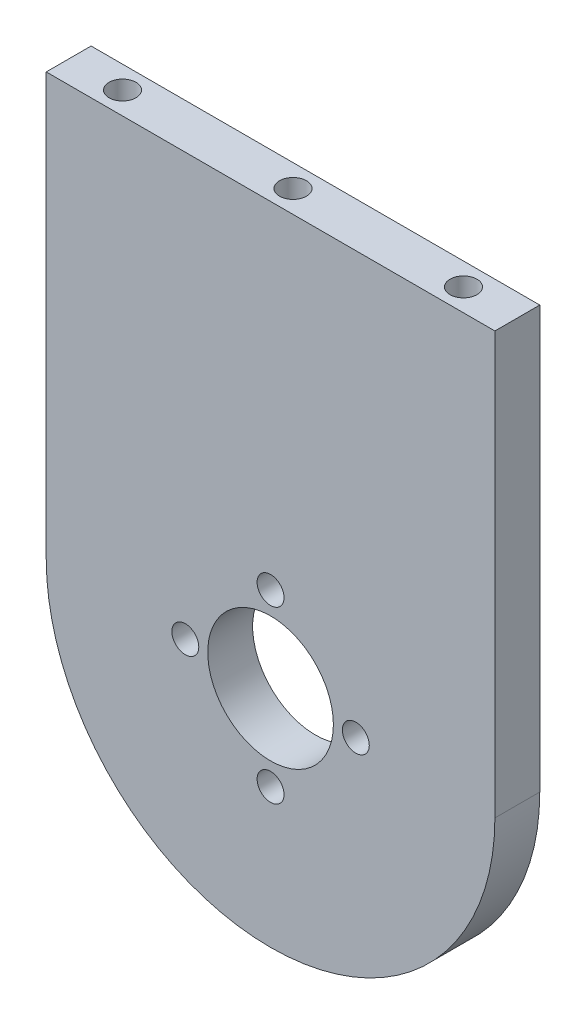
from build123d import *

# Parameters (mm, degrees)
ESQUISSE1_W             = 94
ESQUISSE1_H             = 93.807810261
ESQUISSE1_R             = 7
BOSS_EXTRU_1_DEPTH      = 5
ESQUISSE2_R             = 1.5
ENL_V_MAT_EXTRU_1_DEPTH = 67.655832453
ESQUISSE3_R             = 1.5
ENL_V_MAT_EXTRU_2_DEPTH = 10


with BuildPart() as part:
    # Esquisse1 → Boss.-Extru.1 (new body)
    with BuildSketch(Plane.XY):
        with Locations((0, 0.096094869)):
            Rectangle(ESQUISSE1_W, ESQUISSE1_H)
        Circle(ESQUISSE1_R, mode=Mode.SUBTRACT)
    extrude(amount=BOSS_EXTRU_1_DEPTH)

    # Esquisse2 → Enlèv. mat.-Extru.1 (cut, through all)
    with BuildSketch(Plane.XY.offset(5)):
        with Locations((9.5, 0)):
            Circle(ESQUISSE2_R)
        with BuildLine():
            Line((25, 47), (25, 0))
            ThreePointArc((25, 0), (0, -25), (-25, 0))
            Line((-25, 0), (-25, 47))
            Line((-25, 47), (-47, 47))
            Line((-47, 47), (-47, -46.807810261))
            Line((-47, -46.807810261), (47, -46.807810261))
            Line((47, -46.807810261), (47, 47))
            Line((47, 47), (25, 47))
        make_face()
        with Locations((-9.5, 0)):
            Circle(ESQUISSE2_R)
        with Locations((0, 9.5)):
            Circle(ESQUISSE2_R)
        with Locations((0, -9.5)):
            Circle(ESQUISSE2_R)
    extrude(amount=-ENL_V_MAT_EXTRU_1_DEPTH, mode=Mode.SUBTRACT)

    # Esquisse3 → Enlèv. mat.-Extru.2 (cut)
    with BuildSketch(Plane(origin=(0, 47, 0), x_dir=(1, 0, 0), z_dir=(0, 1, 0))):
        with Locations(Location((0, -2.5, 0), (0, 0, 270))):
            Circle(ESQUISSE3_R)
        with Locations(Location((-19, -2.5, 0), (0, 0, 270))):
            Circle(ESQUISSE3_R)
        with Locations(Location((19, -2.5, 0), (0, 0, 270))):
            Circle(ESQUISSE3_R)
    extrude(amount=-ENL_V_MAT_EXTRU_2_DEPTH, mode=Mode.SUBTRACT)


solid = part.part
